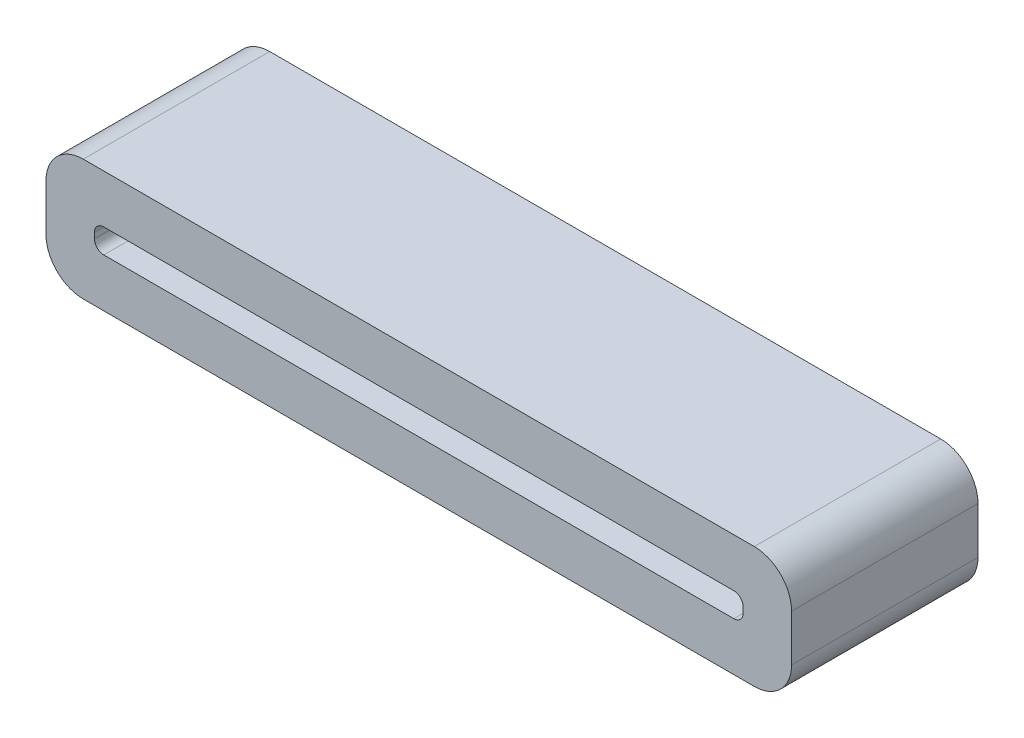
from build123d import *

# Parameters (mm, degrees)
EXTRUSION1_DEPTH = 10


with BuildPart() as part:
    # Esquisse1 → Extrusion1 (new body)
    with BuildSketch(Plane.XY):
        with BuildLine():
            Line((-29.586584832, 9.695126149), (6.413415168, 9.695126149))
            ThreePointArc((6.413415168, 9.695126149), (7.82762873, 9.109339712), (8.413415168, 7.695126149))
            Line((8.413415168, 7.695126149), (8.413415168, 5.195126149))
            ThreePointArc((8.413415168, 5.195126149), (7.82762873, 3.780912587), (6.413415168, 3.195126149))
            Line((6.413415168, 3.195126149), (-29.586584832, 3.195126149))
            ThreePointArc((-29.586584832, 3.195126149), (-31.000798394, 3.780912587), (-31.586584832, 5.195126149))
            Line((-31.586584832, 5.195126149), (-31.586584832, 7.695126149))
            ThreePointArc((-31.586584832, 7.695126149), (-31.000798394, 9.109339712), (-29.586584832, 9.695126149))
        make_face()
        with BuildLine():
            Line((-28.486584832, 7.095126149), (5.313415168, 7.095126149))
            ThreePointArc((5.313415168, 7.095126149), (5.666968559, 6.94867954), (5.813415168, 6.595126149))
            Line((5.813415168, 6.595126149), (5.813415168, 6.295126149))
            ThreePointArc((5.813415168, 6.295126149), (5.666968559, 5.941572759), (5.313415168, 5.795126149))
            Line((5.313415168, 5.795126149), (-28.486584832, 5.795126149))
            ThreePointArc((-28.486584832, 5.795126149), (-28.840138222, 5.941572759), (-28.986584832, 6.295126149))
            Line((-28.986584832, 6.295126149), (-28.986584832, 6.595126149))
            ThreePointArc((-28.986584832, 6.595126149), (-28.840138222, 6.94867954), (-28.486584832, 7.095126149))
        make_face(mode=Mode.SUBTRACT)
    extrude(amount=-EXTRUSION1_DEPTH)


solid = part.part
